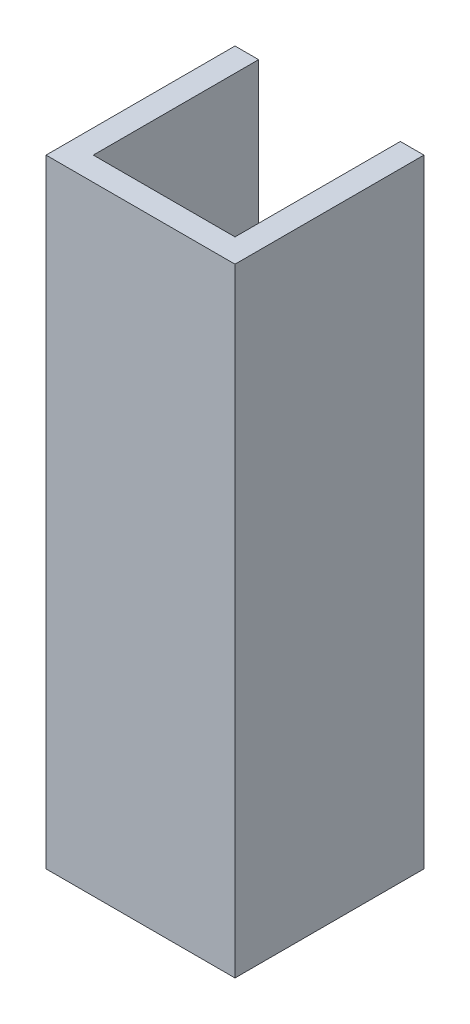
from build123d import *

# Parameters (mm, degrees)
EXTRUDE_THIN1_DEPTH = 83.1


with BuildPart() as part:
    # Sketch1 → Extrude-Thin1 (new body)
    with BuildSketch(Plane(origin=(0, 0, 0), x_dir=(1, 0, 0), z_dir=(0, 1, 0))):
        Polygon((0, 25.4), (0, 0), (25.4, 0), (25.4, 25.4), (22.225, 25.4), (22.225, 3.175), (3.175, 3.175), (3.175, 25.4), align=None)
    extrude(amount=EXTRUDE_THIN1_DEPTH)


solid = part.part
